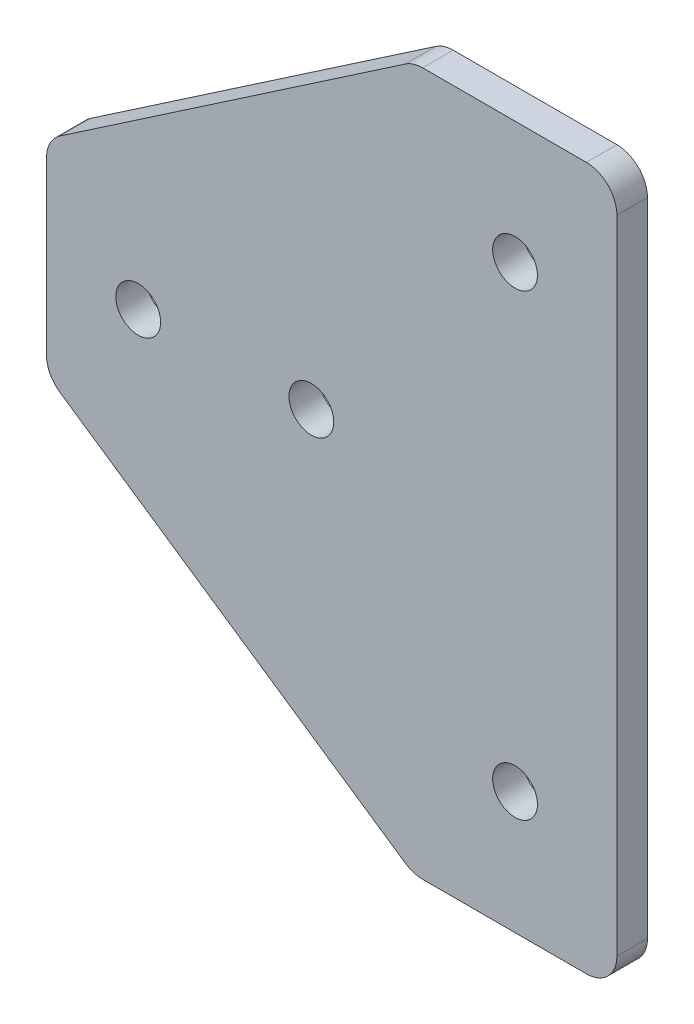
from build123d import *

# Parameters (mm, degrees)
BOSS_EXTRUDE1_DEPTH = 3
SKETCH2_R           = 2.2
CUT_EXTRUDE1_DEPTH  = 66.842615379
FILLET1_R           = 3


with BuildPart() as part:
    # Sketch1 → Boss-Extrude1 (new body)
    with BuildSketch(Plane.XY):
        Polygon((0, -34.5), (0, 34.5), (-20, 34.5), (-56, 10), (-56, -10), (-20, -34.5), align=None)
    extrude(amount=BOSS_EXTRUDE1_DEPTH)

    # Sketch2 → Cut-Extrude1 (cut, through all)
    with BuildSketch(Plane.XY.offset(3)):
        with Locations((-47, 0)):
            Circle(SKETCH2_R)
        with Locations((-30, 0)):
            Circle(SKETCH2_R)
        with Locations((-10, 22.5)):
            Circle(SKETCH2_R)
        with Locations((-10, -22.5)):
            Circle(SKETCH2_R)
    extrude(amount=-CUT_EXTRUDE1_DEPTH, mode=Mode.SUBTRACT)

    # Fillet1
    fillet1_edges = [part.edges().sort_by_distance(p)[0] for p in [
        (-20, -34.5, 1.5),
        (-56, -10, 1.5),
        (-56, 10, 1.5),
        (-20, 34.5, 1.5),
        (0, 34.5, 1.5),
        (0, -34.5, 1.5),
    ]]
    fillet(fillet1_edges, radius=FILLET1_R)


solid = part.part
